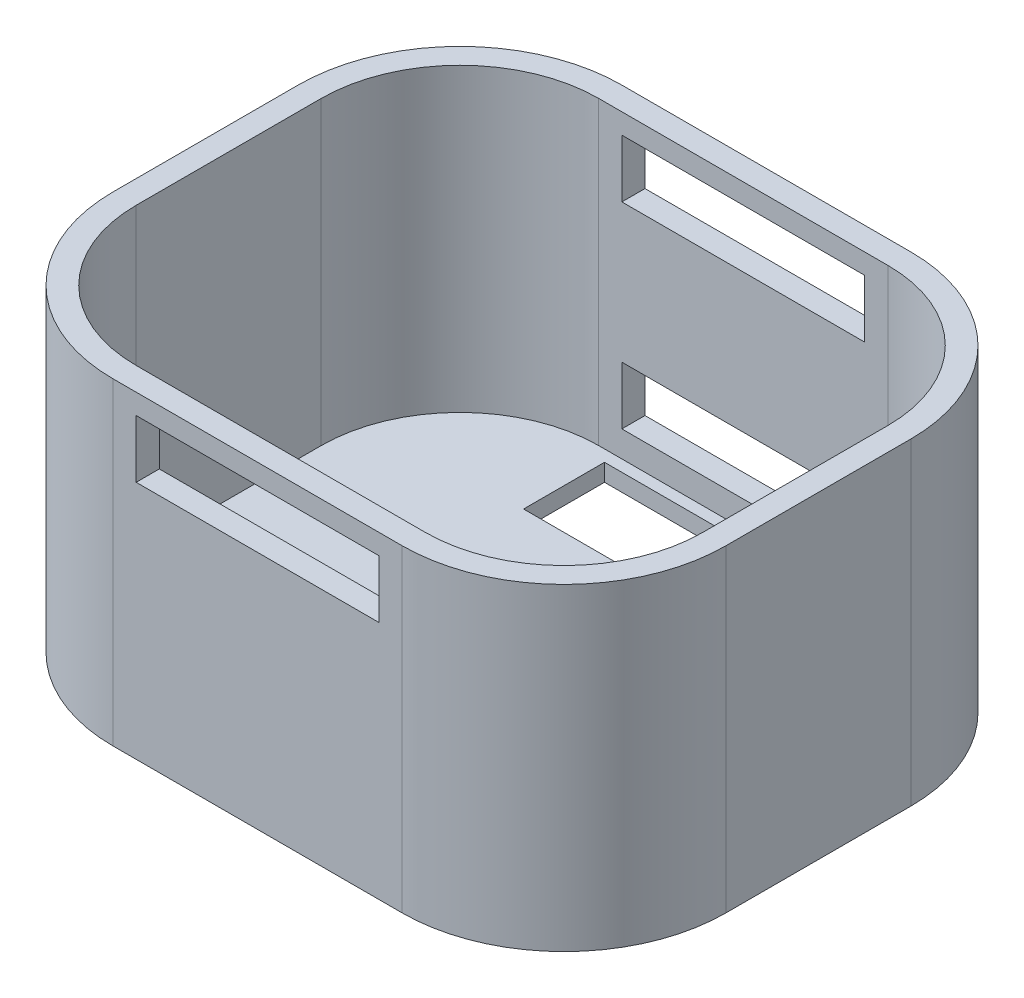
from build123d import *

# Parameters (mm, degrees)
BOSS_EXTRUDE1_DEPTH     = 13.75
CUT_EXTRUDE1_DEPTH      = 52.529724432
CUT_EXTRUDE1_DEPTH_BACK = 52.529724432
SKETCH2_W               = 21
SKETCH2_H               = 5
BOSS_EXTRUDE2_START     = -1.5
BOSS_EXTRUDE2_DEPTH     = 1.5
SKETCH4_W               = 21
SKETCH4_H               = 5
CUT_EXTRUDE2_DEPTH      = 2
SKETCH5_W               = 22
SKETCH5_H               = 7
CUT_EXTRUDE3_DEPTH      = 2


with BuildPart() as part:
    # Sketch1 → Boss-Extrude1 (new, symmetric)
    with BuildSketch(Plane(origin=(0, 0, 0), x_dir=(1, 0, 0), z_dir=(0, 1, 0))):
        with BuildLine():
            Line((-26.5, 8), (-26.5, -8))
            ThreePointArc((-26.5, -8), (-22.399494937, -17.899494937), (-12.5, -22))
            Line((-12.5, -22), (12.5, -22))
            ThreePointArc((12.5, -22), (22.399494937, -17.899494937), (26.5, -8))
            Line((26.5, -8), (26.5, 8))
            ThreePointArc((26.5, 8), (22.399494937, 17.899494937), (12.5, 22))
            Line((12.5, 22), (-12.5, 22))
            ThreePointArc((-12.5, 22), (-22.399494937, 17.899494937), (-26.5, 8))
        make_face()
        with BuildLine():
            Line((12.5, -20), (-12.5, -20))
            ThreePointArc((-12.5, -20), (-20.985281374, -16.485281374), (-24.5, -8))
            Line((-24.5, -8), (-24.5, 8))
            ThreePointArc((-24.5, 8), (-20.985281374, 16.485281374), (-12.5, 20))
            Line((-12.5, 20), (12.5, 20))
            ThreePointArc((12.5, 20), (20.985281374, 16.485281374), (24.5, 8))
            Line((24.5, 8), (24.5, -8))
            ThreePointArc((24.5, -8), (20.985281374, -16.485281374), (12.5, -20))
        make_face(mode=Mode.SUBTRACT)
    extrude(amount=BOSS_EXTRUDE1_DEPTH, both=True)

    # Sketch2 → Cut-Extrude1 (cut, two sides: drawn at the far end of the back side and taken through both)
    with BuildSketch(Plane.XY.offset(-20).offset(-CUT_EXTRUDE1_DEPTH_BACK)):
        with Locations((0, 9.5)):
            Rectangle(SKETCH2_W, SKETCH2_H)
    extrude(amount=CUT_EXTRUDE1_DEPTH + CUT_EXTRUDE1_DEPTH_BACK, mode=Mode.SUBTRACT)

    # Sketch3 → Boss-Extrude2 (add)
    with BuildSketch(Plane.XZ.offset(13.75).offset(BOSS_EXTRUDE2_START)):
        with BuildLine():
            Line((-12.5, -22), (12.5, -22))
            ThreePointArc((12.5, -22), (22.399494937, -17.899494937), (26.5, -8))
            Line((26.5, -8), (26.5, 8))
            ThreePointArc((26.5, 8), (22.399494937, 17.899494937), (12.5, 22))
            Line((12.5, 22), (-12.5, 22))
            ThreePointArc((-12.5, 22), (-22.399494937, 17.899494937), (-26.5, 8))
            Line((-26.5, 8), (-26.5, -8))
            ThreePointArc((-26.5, -8), (-22.399494937, -17.899494937), (-12.5, -22))
        make_face()
    extrude(amount=BOSS_EXTRUDE2_DEPTH)

    # Sketch4 → Cut-Extrude2 (cut)
    with BuildSketch(Plane(origin=(0, 0, -22), x_dir=(-1, 0, 0), z_dir=(0, 0, -1))):
        with Locations((0, -7.5)):
            Rectangle(SKETCH4_W, SKETCH4_H)
    extrude(amount=-CUT_EXTRUDE2_DEPTH, mode=Mode.SUBTRACT)

    # Sketch5 → Cut-Extrude3 (cut)
    with BuildSketch(Plane(origin=(0, -12.25, 0), x_dir=(-1, 0, 0), z_dir=(0, 1, 0))):
        with Locations((0, -15.5)):
            Rectangle(SKETCH5_W, SKETCH5_H)
    extrude(amount=-CUT_EXTRUDE3_DEPTH, mode=Mode.SUBTRACT)


solid = part.part
